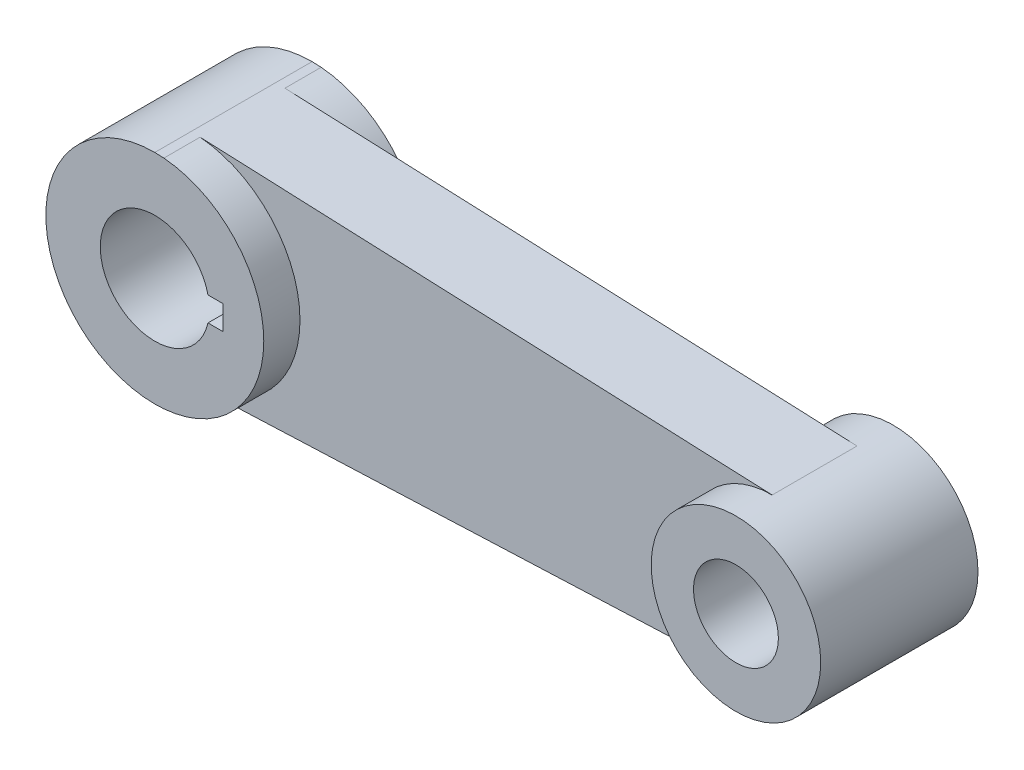
from build123d import *

# Parameters (mm, degrees)
SKETCH1_R               = 7.1501
BOSS_EXTRUDE1_DEPTH     = 4.7498
SKETCH1_R_2             = 11.1125
SKETCH1_R_3             = 5.5626
BOSS_EXTRUDE1_2_DEPTH   = 4.7498
BOSS_EXTRUDE2_DEPTH     = 11.1252
BOSS_EXTRUDE3_START     = -15.875
SKETCH1_4_R             = 7.1501
SKETCH1_4_R_2           = 11.1125
SKETCH1_4_R_3           = 5.5626
BOSS_EXTRUDE3_DEPTH     = 15.875
CUT_EXTRUDE2_DEPTH      = 4.826
CUT_EXTRUDE2_DEPTH_BACK = 4.6736


with BuildPart() as part:
    # Sketch1 → Boss-Extrude1 (new body)
    with BuildSketch(Plane.XY):
        with BuildLine():
            Line((1.188561525, 14.237976603), (0, 14.2875))
            ThreePointArc((0, 14.2875), (-14.2875, 0), (0, -14.2875))
            Line((0, -14.2875), (1.188561525, -14.237976603))
            ThreePointArc((1.188561525, -14.237976603), (14.2875, 0), (1.188561525, 14.237976603))
        make_face()
        Circle(SKETCH1_R, mode=Mode.SUBTRACT)
    extrude(amount=BOSS_EXTRUDE1_DEPTH)



with BuildPart() as body_2:
    # Sketch1 → Boss-Extrude1 2 (new body)
    with BuildSketch(Plane.XY):
        with Locations((76.2, 0)):
            Circle(SKETCH1_R_2)
        with Locations((76.2, 0)):
            Circle(SKETCH1_R_3, mode=Mode.SUBTRACT)
    extrude(amount=BOSS_EXTRUDE1_2_DEPTH)


with BuildPart() as body_3:
    # Sketch1<3> → Boss-Extrude2 (new body)
    with BuildSketch(Plane.XY):
        with BuildLine():
            Line((76.2, 11.1125), (1.188561525, 14.237976603))
            ThreePointArc((1.188561525, 14.237976603), (10.514614331, 9.673445184), (14.2875, 0))
            ThreePointArc((14.2875, 0), (10.514614331, -9.673445184), (1.188561525, -14.237976603))
            Line((1.188561525, -14.237976603), (76.2, -11.1125))
            ThreePointArc((76.2, -11.1125), (65.0875, 0), (76.2, 11.1125))
        make_face()
    extrude(amount=-BOSS_EXTRUDE2_DEPTH)


with BuildPart() as part_1:
    add(part.part)

    add(body_2.part)  # Boss-Extrude3 merges body 2

    add(body_3.part)  # Boss-Extrude3 merges body 3
    # Sketch1<4> → Boss-Extrude3 (add)
    # profile 1 of 2: a face of its own
    with BuildSketch(Plane.XY.offset(BOSS_EXTRUDE3_START)):
        with BuildLine():
            Line((1.188561525, 14.237976603), (0, 14.2875))
            ThreePointArc((0, 14.2875), (-14.2875, 0), (0, -14.2875))
            Line((0, -14.2875), (1.188561525, -14.237976603))
            ThreePointArc((1.188561525, -14.237976603), (14.2875, 0), (1.188561525, 14.237976603))
        make_face()
        Circle(SKETCH1_4_R, mode=Mode.SUBTRACT)
    # profile 2 of 2: a face of its own
    with BuildSketch(Plane.XY.offset(BOSS_EXTRUDE3_START)):
        with Locations((76.2, 0)):
            Circle(SKETCH1_4_R_2)
        with Locations((76.2, 0)):
            Circle(SKETCH1_4_R_3, mode=Mode.SUBTRACT)
    extrude(amount=BOSS_EXTRUDE3_DEPTH)

    # Sketch2 → Cut-Extrude2 (cut, two sides: drawn at the far end of the back side and taken through both)
    with BuildSketch(Plane.XY.offset(-CUT_EXTRUDE2_DEPTH_BACK)):
        Polygon((6.971640679, 0), (6.971640679, 1.5875), (8.927440679, 1.5875), (8.927440679, -1.5875), (6.971640679, -1.5875), align=None)
    extrude(amount=CUT_EXTRUDE2_DEPTH + CUT_EXTRUDE2_DEPTH_BACK, mode=Mode.SUBTRACT)


solid = part_1.part
